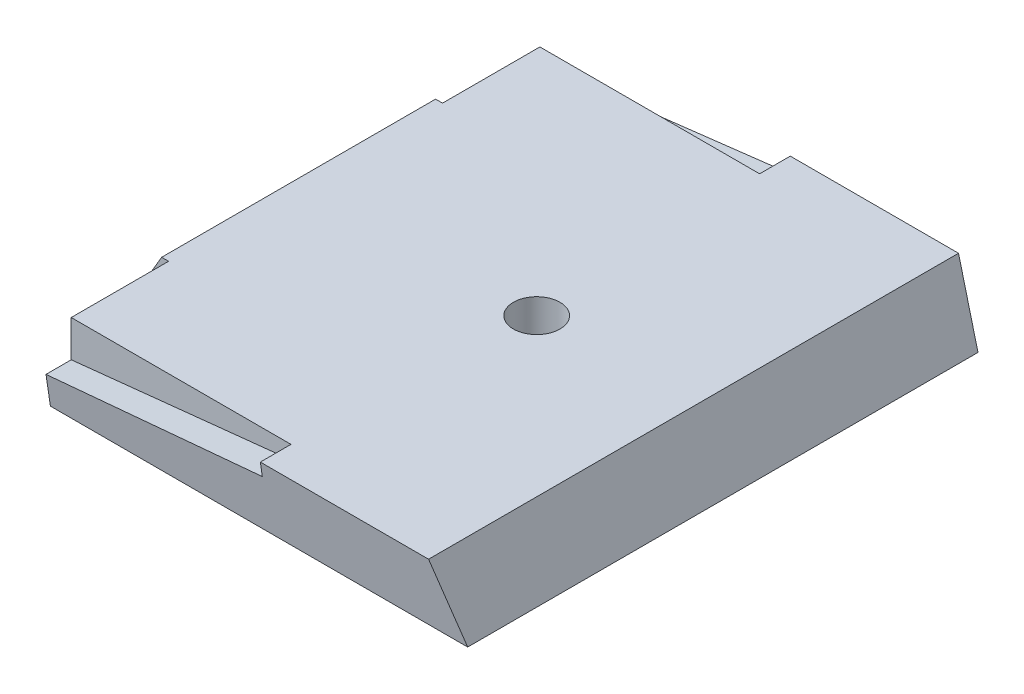
from build123d import *

# Parameters (mm, degrees)
SKETCH1_W           = 63.22
SKETCH1_H           = 72.35
BOSS_EXTRUDE1_DEPTH = 9.06
CUT_EXTRUDE1_REACH  = 98.506
CUT_EXTRUDE2_REACH  = 98.506
SKETCH3_W           = 6.25
SKETCH3_H           = 17.475
CUT_EXTRUDE3_DEPTH  = 4.185
CUT_EXTRUDE4_START  = -72.35
CUT_EXTRUDE4_DEPTH  = 4.185
CUT_EXTRUDE6_REACH  = 98.506
CUT_EXTRUDE7_REACH  = 94.532
CUT_EXTRUDE8_REACH  = 98.506
SKETCH9_R           = 3.175
SKETCH9_3_R         = 3.175
CUT_EXTRUDE9_DEPTH  = 4.3


with BuildPart() as part:
    # Sketch1 → Boss-Extrude1 (new body)
    with BuildSketch(Plane(origin=(0, 0, 0), x_dir=(1, 0, 0), z_dir=(0, 1, 0))):
        with Locations((-31.61, -36.175)):
            Rectangle(SKETCH1_W, SKETCH1_H)
    extrude(amount=BOSS_EXTRUDE1_DEPTH)

    # Sketch2 → Cut-Extrude1 (cut, up to next)
    with BuildSketch(Plane.XY.offset(72.35), mode=Mode.PRIVATE) as cut_extrude1_sk1:
        Polygon((-63.22, 9.06), (-57.92, 9.06), (-63.22, 0), align=None)
    cut_extrude1_tool1 = extrude(cut_extrude1_sk1.sketch, amount=-CUT_EXTRUDE1_REACH, mode=Mode.PRIVATE) & part.part
    add(cut_extrude1_tool1.solids().sort_by_distance((-61.453333, 6.04, 72.35))[0], mode=Mode.SUBTRACT)

    # Sketch3 → Cut-Extrude2 (cut, up to next)
    with BuildSketch(Plane.XZ, mode=Mode.PRIVATE) as cut_extrude2_sk1:
        with Locations((-60.095, 63.6125)):
            Rectangle(SKETCH3_W, SKETCH3_H)
    cut_extrude2_tool1 = extrude(cut_extrude2_sk1.sketch, amount=-CUT_EXTRUDE2_REACH, mode=Mode.PRIVATE) & part.part
    # Sketch3 → Cut-Extrude2 (cut, up to next)
    with BuildSketch(Plane.XZ, mode=Mode.PRIVATE) as cut_extrude2_sk2:
        with Locations((-60.095, 8.7375)):
            Rectangle(SKETCH3_W, SKETCH3_H)
    cut_extrude2_tool2 = extrude(cut_extrude2_sk2.sketch, amount=-CUT_EXTRUDE2_REACH, mode=Mode.PRIVATE) & part.part
    add(cut_extrude2_tool1.solids().sort_by_distance((-60.095, 0, 63.6125))[0], mode=Mode.SUBTRACT)
    add(cut_extrude2_tool2.solids().sort_by_distance((-60.095, 0, 8.7375))[0], mode=Mode.SUBTRACT)

    # Sketch4 → Cut-Extrude3 (cut)
    with BuildSketch(Plane.XY.offset(72.35)):
        Polygon((-56.97, 9.06), (-56.97, 4.06), (-26.97, 7.21), (-26.97, 9.06), align=None)
    extrude(amount=-CUT_EXTRUDE3_DEPTH, mode=Mode.SUBTRACT)

    # Sketch4<2> → Cut-Extrude4 (cut)
    with BuildSketch(Plane.XY.offset(72.35).offset(CUT_EXTRUDE4_START)):
        Polygon((-56.97, 9.06), (-56.97, 4.06), (-26.97, 7.21), (-26.97, 9.06), align=None)
    extrude(amount=CUT_EXTRUDE4_DEPTH, mode=Mode.SUBTRACT)

    # Sketch7 → Cut-Extrude6 (cut, up to next)
    with BuildSketch(Plane.XY.offset(72.35), mode=Mode.PRIVATE) as cut_extrude6_sk1:
        Polygon((0, 0), (-4, 9.06), (0, 9.06), align=None)
    cut_extrude6_tool1 = extrude(cut_extrude6_sk1.sketch, amount=-CUT_EXTRUDE6_REACH, mode=Mode.PRIVATE) & part.part
    add(cut_extrude6_tool1.solids().sort_by_distance((-1.333333, 6.04, 72.35))[0], mode=Mode.SUBTRACT)

    # Sketch8 → Cut-Extrude7 (cut, up to next)
    with BuildSketch(Plane.ZY.offset(56.97), mode=Mode.PRIVATE) as cut_extrude7_sk1:
        Polygon((72.35, 0), (71.01, 0), (72.35, 9.06), align=None)
    cut_extrude7_tool1 = extrude(cut_extrude7_sk1.sketch, amount=-CUT_EXTRUDE7_REACH, mode=Mode.PRIVATE) & part.part
    # Sketch8 → Cut-Extrude7 (cut, up to next)
    with BuildSketch(Plane.ZY.offset(56.97), mode=Mode.PRIVATE) as cut_extrude7_sk2:
        Polygon((0, 0), (1.34, 0), (0, 9.06), align=None)
    cut_extrude7_tool2 = extrude(cut_extrude7_sk2.sketch, amount=-CUT_EXTRUDE7_REACH, mode=Mode.PRIVATE) & part.part
    add(cut_extrude7_tool1.solids().sort_by_distance((-56.97, 3.02, 71.903333))[0], mode=Mode.SUBTRACT)
    add(cut_extrude7_tool2.solids().sort_by_distance((-56.97, 3.02, 0.446667))[0], mode=Mode.SUBTRACT)

    # Sketch9 → Cut-Extrude8 (cut, up to next)
    with BuildSketch(Plane.XZ, mode=Mode.PRIVATE) as cut_extrude8_sk1:
        with Locations(Location((-25.415, 36.175, 0), (0, 0, 270))):
            Circle(SKETCH9_R)
    cut_extrude8_tool1 = extrude(cut_extrude8_sk1.sketch, amount=-CUT_EXTRUDE8_REACH, mode=Mode.PRIVATE) & part.part
    add(cut_extrude8_tool1.solids().sort_by_distance((-25.415, 0, 36.175))[0], mode=Mode.SUBTRACT)

    # Sketch9<3> → Cut-Extrude9 (cut)
    with BuildSketch(Plane.XZ):
        Polygon((-22.269171962, 41.691982807), (-28.619933244, 41.6578584), (-31.765761282, 36.140875593), (-28.560828038, 30.658017193), (-22.210066756, 30.6921416), (-19.064238718, 36.209124407), align=None)
        with Locations(Location((-25.415, 36.175, 0), (0, 0, 270))):
            Circle(SKETCH9_3_R, mode=Mode.SUBTRACT)
    extrude(amount=-CUT_EXTRUDE9_DEPTH, mode=Mode.SUBTRACT)


solid = part.part
